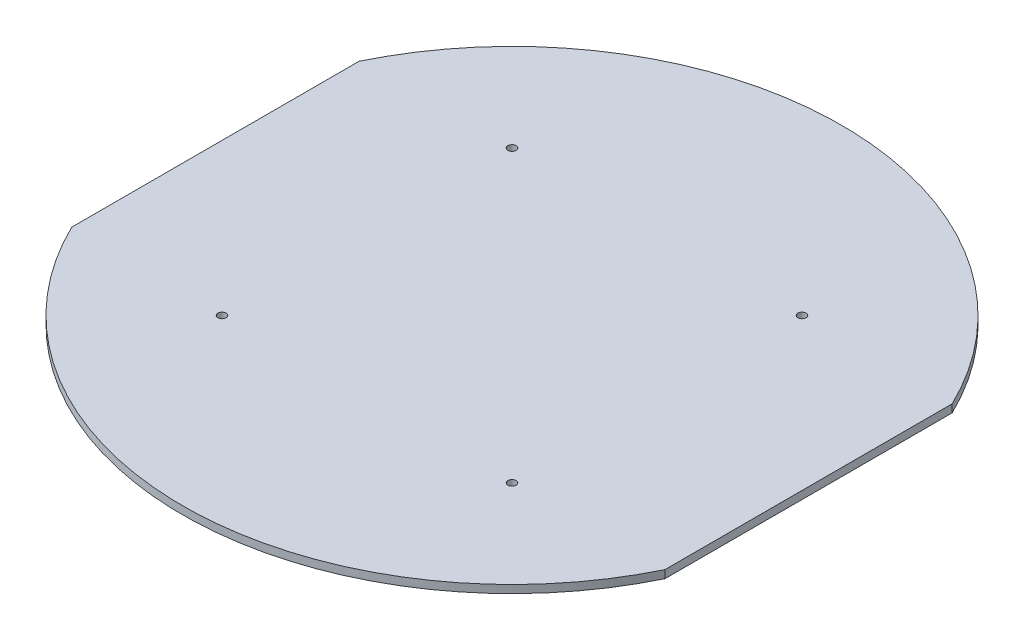
from build123d import *

# Parameters (mm, degrees)
SKETCH1_R           = 1.55
BOSS_EXTRUDE1_DEPTH = 3


with BuildPart() as part:
    # Sketch1 → Boss-Extrude1 (new body)
    with BuildSketch(Plane(origin=(0, 0, 0), x_dir=(1, 0, 0), z_dir=(0, 1, 0))):
        with BuildLine():
            ThreePointArc((112.5, 54.486236794), (0, 125), (-112.5, 54.486236794))
            Line((-112.5, 54.486236794), (-112.5, -54.486236794))
            ThreePointArc((-112.5, -54.486236794), (0, -125), (112.5, -54.486236794))
            Line((112.5, -54.486236794), (112.5, 54.486236794))
        make_face()
        with Locations(Location((-55, -55, 0), (0, 0, 270))):
            Circle(SKETCH1_R, mode=Mode.SUBTRACT)
        with Locations(Location((55, -55, 0), (0, 0, 270))):
            Circle(SKETCH1_R, mode=Mode.SUBTRACT)
        with Locations(Location((-55, 55, 0), (0, 0, 270))):
            Circle(SKETCH1_R, mode=Mode.SUBTRACT)
        with Locations(Location((55, 55, 0), (0, 0, 270))):
            Circle(SKETCH1_R, mode=Mode.SUBTRACT)
    extrude(amount=BOSS_EXTRUDE1_DEPTH)


solid = part.part
